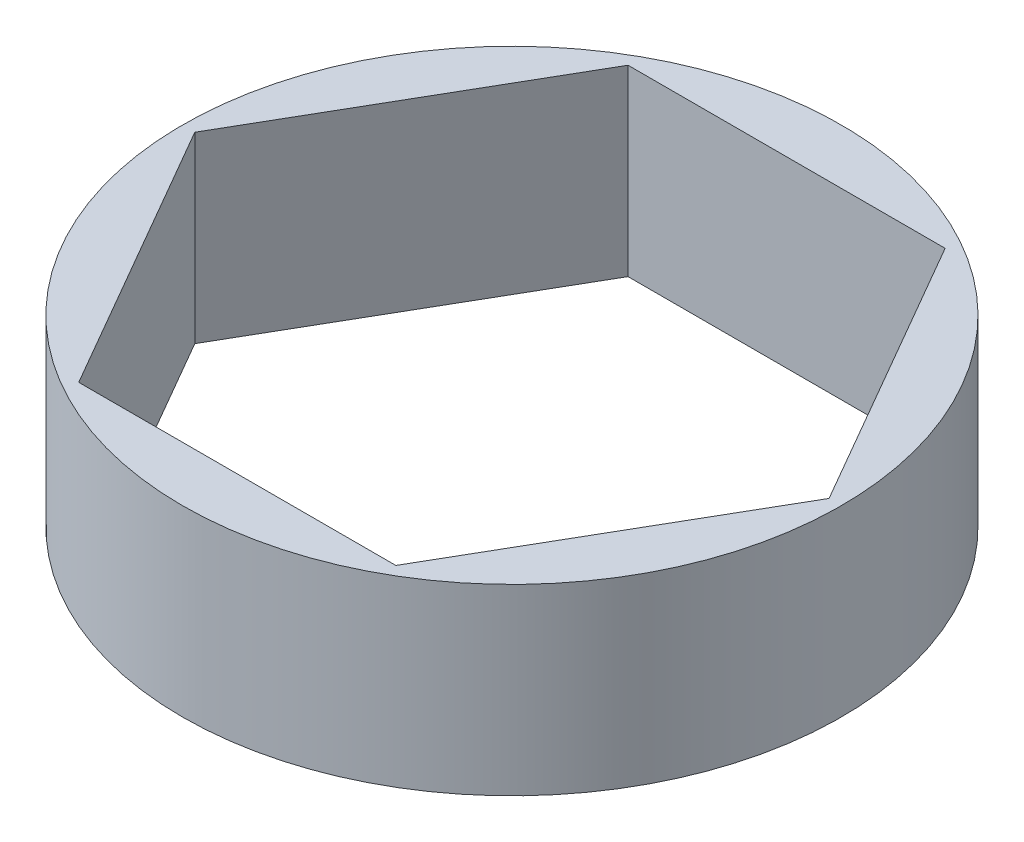
from build123d import *

# Parameters (mm, degrees)
SKETCH1_R           = 9
BOSS_EXTRUDE1_DEPTH = 5


with BuildPart() as part:
    # Sketch1 → Boss-Extrude1 (new body)
    with BuildSketch(Plane(origin=(0, 0, 0), x_dir=(1, 0, 0), z_dir=(0, 1, 0))):
        with Locations(Location((0, 0, 0), (0, 0, 270))):
            Circle(SKETCH1_R)
        Polygon((8.660254038, 0), (4.330127019, 7.5), (-4.330127019, 7.5), (-8.660254038, 0), (-4.330127019, -7.5), (4.330127019, -7.5), align=None, mode=Mode.SUBTRACT)
    extrude(amount=BOSS_EXTRUDE1_DEPTH)


solid = part.part
